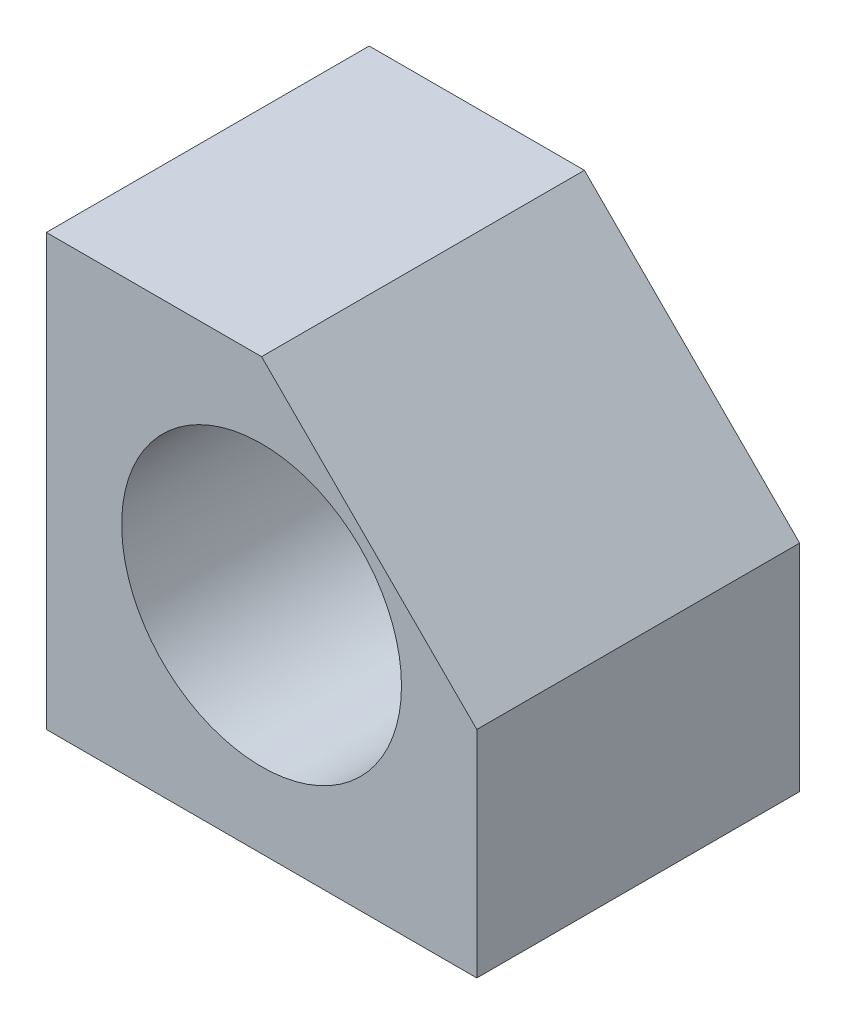
from build123d import *

# Parameters (mm, degrees)
SKETCH1_W           = 4
SKETCH1_H           = 4
SKETCH1_R           = 1.3
BOSS_EXTRUDE1_DEPTH = 3
CHAMFER1_SIZE       = 2


with BuildPart() as part:
    # Sketch1 → Boss-Extrude1 (new body)
    with BuildSketch(Plane.XY):
        with Locations((167.269999999, -60.420000001)):
            Rectangle(SKETCH1_W, SKETCH1_H)
        with Locations((167.269999999, -60.420000001)):
            Circle(SKETCH1_R, mode=Mode.SUBTRACT)
    extrude(amount=BOSS_EXTRUDE1_DEPTH)

    # Chamfer1
    chamfer1_edges = [part.edges().sort_by_distance(p)[0] for p in [
        (169.269999999, -58.420000001, 1.5),
    ]]
    chamfer(chamfer1_edges, length=CHAMFER1_SIZE)


solid = part.part
